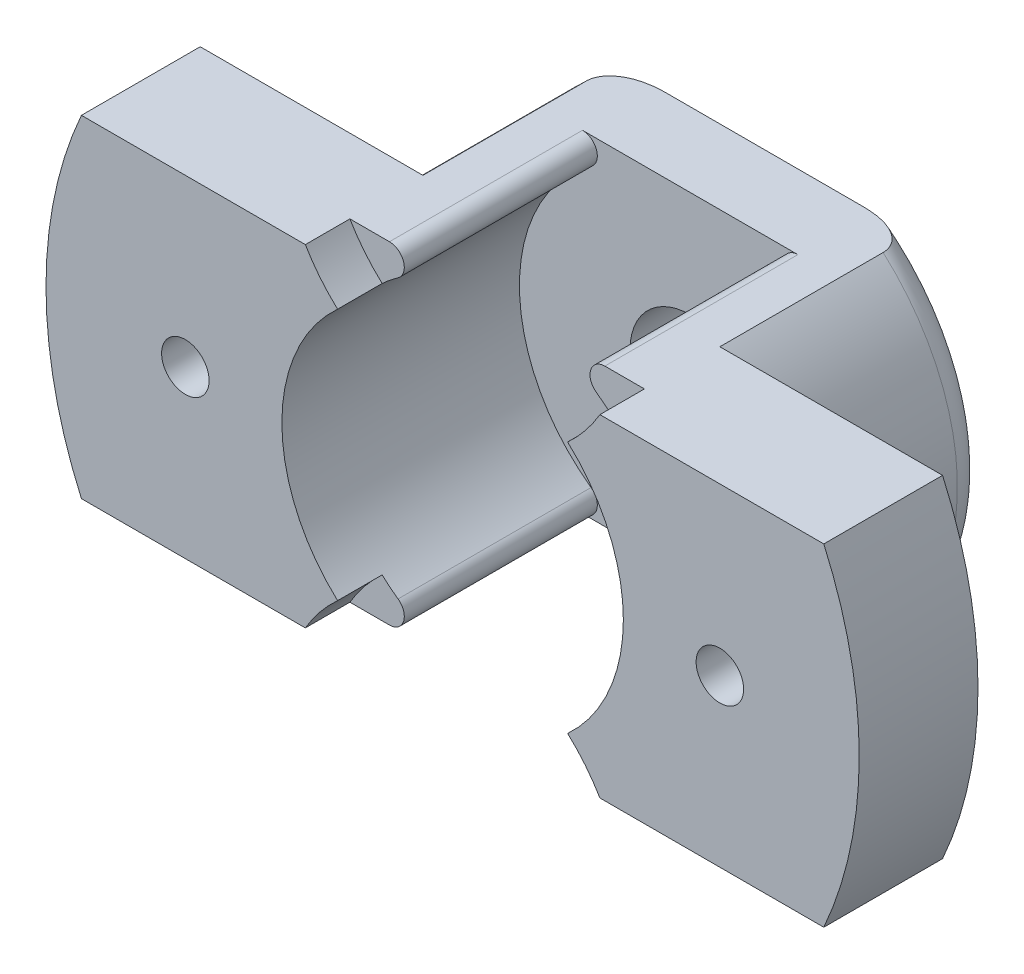
from build123d import *

# Parameters (mm, degrees)
SKETCH_1_W          = 20
SKETCH_1_H          = 22.3606797749979
EXTRUDE_1_DEPTH     = 5
SKETCH_2_R          = 4.05
CUT_EXTRUDE_1_DEPTH = 5
EXTRUDE_2_DEPTH     = 16
EXTRUDE_START       = -8
EXTRUDE_3_DEPTH     = 8
SKETCH_5_R          = 11.5
CUT_EXTRUDE_2_DEPTH = 3
FILLET_2_R          = 2
SKETCH_6_R          = 1.6000000000000016
CUT_EXTRUDE_3_DEPTH = 13
FILLET_3_R          = 1


with BuildPart() as part:
    # 草图1 → 凸台-拉伸1 (new body)
    with BuildSketch(Plane.XY):
        with BuildLine():
            Line((-10, -11.18033988749895), (-10, 11.18033988749895))
            ThreePointArc((-10, 11.180339887498945), (-14.999999999999998, 1.84e-15), (-10.000000000000004, -11.180339887498944))
        make_face()
        Rectangle(SKETCH_1_W, SKETCH_1_H)
        with BuildLine():
            ThreePointArc((14.999999999999998, 0), (13.69306393762915, 6.123724356957945), (9.999999999999998, 11.180339887498947))
            Line((10, 11.18033988749895), (10, -11.18033988749895))
            ThreePointArc((9.999999999999998, -11.180339887498947), (13.69306393762915, -6.123724356957946), (14.999999999999998, -3.67e-15))
        make_face()
    extrude(amount=EXTRUDE_1_DEPTH)

    # 草图2 → 切除-拉伸1 (cut)
    with BuildSketch(Plane(origin=(0, 0, 0), x_dir=(-1, 0, 0), z_dir=(0, 0, -1))):
        Circle(SKETCH_2_R)
    extrude(amount=-CUT_EXTRUDE_1_DEPTH, mode=Mode.SUBTRACT)

    # 草图3 → 凸台-拉伸2 (add)
    with BuildSketch(Plane.XY.offset(5)):
        with BuildLine():
            Line((-10, 11.18033988749895), (-2.6925824035672443, 11.18033988749895))
            ThreePointArc((-2.6925824035672443, 11.18033988749895), (-11.5, 1.41e-15), (-2.6925824035672443, -11.18033988749895))
            Line((-2.6925824035672443, -11.18033988749895), (-10, -11.18033988749895))
            ThreePointArc((-10, -11.18033988749895), (-15.000000000000002, 1.84e-15), (-10, 11.18033988749895))
        make_face()
        with BuildLine():
            Line((2.692582403567243, 11.18033988749895), (10, 11.18033988749895))
            ThreePointArc((10, 11.18033988749895), (15.000000000000002, 0), (10, -11.18033988749895))
            Line((10, -11.18033988749895), (2.6925824035672443, -11.18033988749895))
            ThreePointArc((2.6925824035672443, -11.18033988749895), (11.5, 0), (2.692582403567243, 11.18033988749895))
        make_face()
    extrude(amount=EXTRUDE_2_DEPTH)

    # 草图4 → 凸台-拉伸3 (add)
    with BuildSketch(Plane.XY.offset(21).offset(EXTRUDE_START)):
        with BuildLine():
            Line((10, -11.18033988749895), (25, -11.18033988749895))
            ThreePointArc((25, -11.18033988749895), (27.386127875258307, 0), (25, 11.180339887498949))
            Line((25, 11.180339887498949), (10, 11.18033988749895))
            ThreePointArc((10, 11.18033988749895), (15.000000000000002, 0), (10, -11.18033988749895))
        make_face()
    extrude_3 = extrude(amount=EXTRUDE_3_DEPTH)

    # 镜向1: 凸台-拉伸3 across plane
    add(extrude_3.mirror(Plane(origin=(0, 0, 0), x_dir=(0, 0, 1), z_dir=(1, 0, 0))))

    # 草图5 → 切除-拉伸2 (cut)
    with BuildSketch(Plane.XY.offset(21)):
        with Locations((0, 17)):
            Circle(SKETCH_5_R)
        with Locations((0, -17)):
            Circle(SKETCH_5_R)
    extrude(amount=-CUT_EXTRUDE_2_DEPTH, mode=Mode.SUBTRACT)

    # 圆角2
    fillet_2_edges = [part.edges().sort_by_distance(p)[0] for p in [
        (14.999999999999998, 3.55e-15, 0),
        (-14.999999999999996, 2.22e-15, 0),
    ]]
    fillet(fillet_2_edges, radius=FILLET_2_R)

    # 草图6 → 切除-拉伸3 (cut)
    with BuildSketch(Plane.XY.offset(21)):
        with Locations((18, 0)):
            Circle(SKETCH_6_R)
        with Locations((-18, 0)):
            Circle(SKETCH_6_R)
    extrude(amount=-CUT_EXTRUDE_3_DEPTH, mode=Mode.SUBTRACT)

    # 圆角3
    fillet_3_edges = [part.edges().sort_by_distance(p)[0] for p in [
        (2.6925824035672443, -11.18033988749895, 11.5),
        (2.6925824035672443, 11.18033988749895, 11.5),
        (-2.6925824035672443, 11.18033988749895, 11.5),
        (-2.6925824035672434, -11.18033988749895, 11.5),
    ]]
    fillet(fillet_3_edges, radius=FILLET_3_R)


solid = part.part
